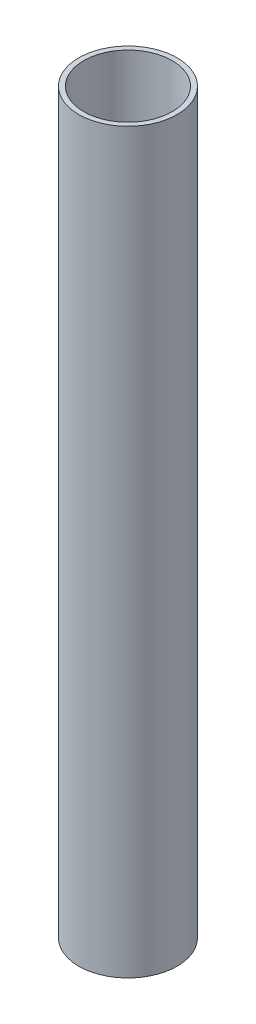
from build123d import *

# Parameters (mm, degrees)
SKETCH_1_R      = 20
SKETCH_1_R_2    = 18
EXTRUDE_1_DEPTH = 300


with BuildPart() as part:
    # 草图1 → 凸台-拉伸1 (new body)
    with BuildSketch(Plane(origin=(0, 0, 0), x_dir=(1, 0, 0), z_dir=(0, 1, 0))):
        with Locations(Location((0, 0, 0), (0, 0, 270))):
            Circle(SKETCH_1_R)
        with Locations(Location((0, 0, 0), (0, 0, 270))):
            Circle(SKETCH_1_R_2, mode=Mode.SUBTRACT)
    extrude(amount=EXTRUDE_1_DEPTH)


solid = part.part
